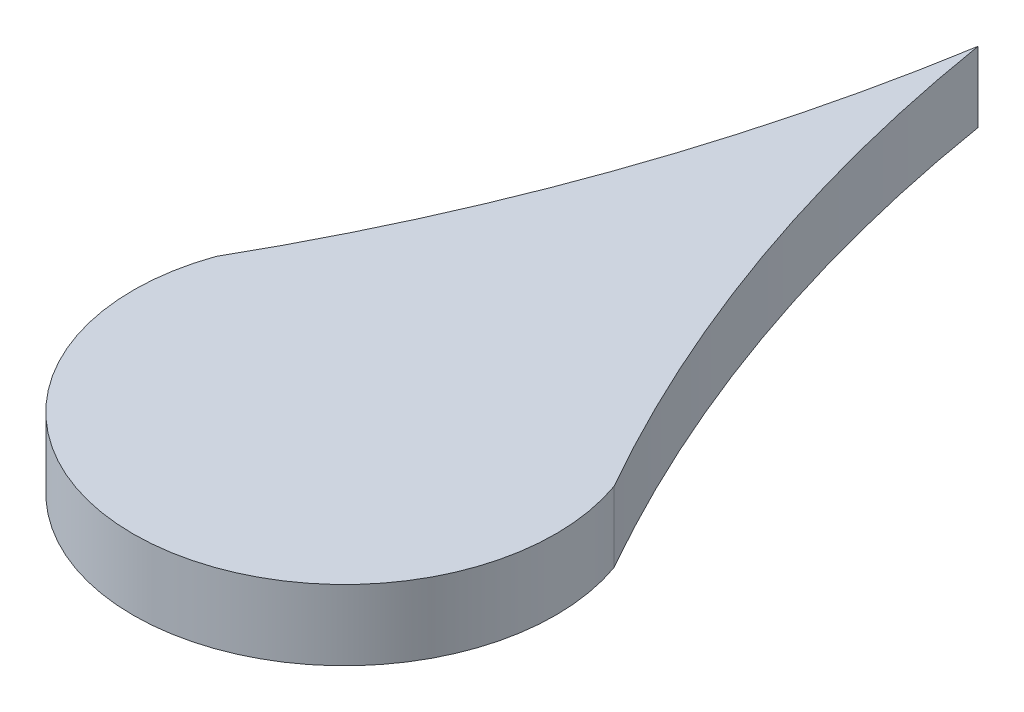
from build123d import *

# Parameters (mm, degrees)
BOSS_EXTRUDE1_DEPTH = 6.35


with BuildPart() as part:
    # Sketch1 → Boss-Extrude1 (new body)
    with BuildSketch(Plane(origin=(0, 0, 0), x_dir=(1, 0, 0), z_dir=(0, 1, 0))):
        with BuildLine():
            ThreePointArc((-17.960512242, 6.35), (0, -19.05), (17.960512242, 6.35))
            ThreePointArc((17.960512242, 6.35), (6.717373, 30.94995), (0, 57.15))
            ThreePointArc((0, 57.15), (-6.717373, 30.94995), (-17.960512242, 6.35))
        make_face()
    extrude(amount=BOSS_EXTRUDE1_DEPTH)


solid = part.part
